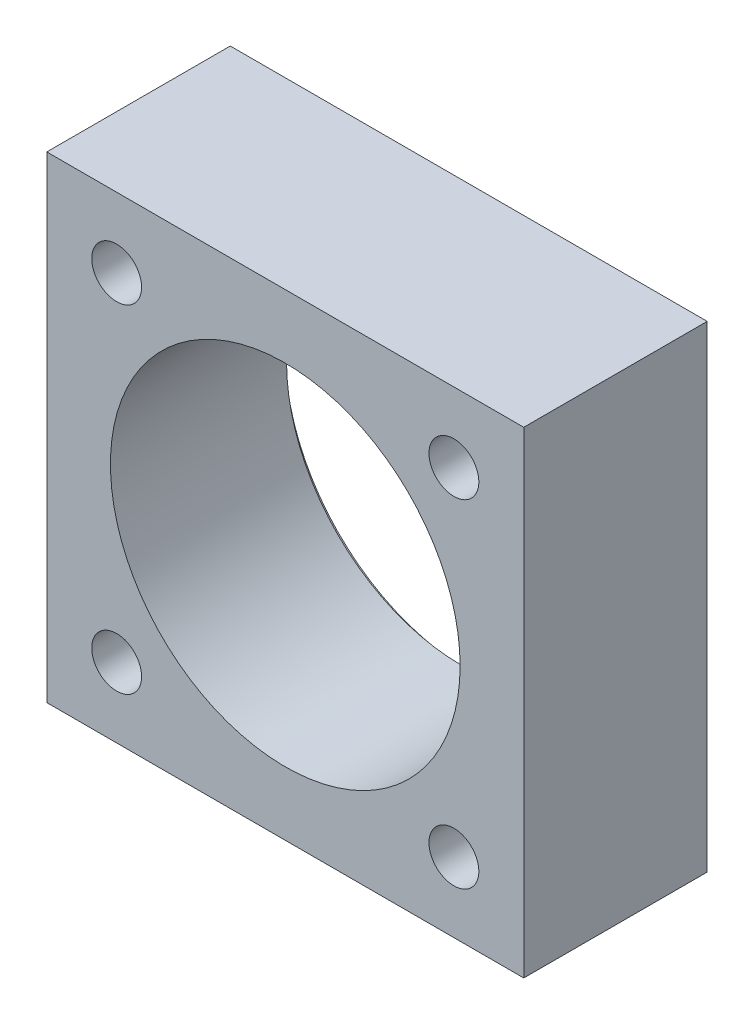
from build123d import *

# Parameters (mm, degrees)
SKETCH2_W             = 33.02
SKETCH2_H             = 33.02
BOSS_EXTRUDE1_DEPTH   = 12.7
SKETCH3_R             = 12.10437
CUT_EXTRUDE1_DEPTH    = 27.579130911
F_8_32_TAPPED_HOLE1_D = 3.4544
SKETCH9_R             = 12.7
CUT_EXTRUDE2_DEPTH    = 0.508


with BuildPart() as part:
    # Sketch2 → Boss-Extrude1 (new body)
    with BuildSketch(Plane.XY):
        Rectangle(SKETCH2_W, SKETCH2_H)
    extrude(amount=BOSS_EXTRUDE1_DEPTH)

    # Sketch3 → Cut-Extrude1 (cut, through all)
    with BuildSketch(Plane.XY.offset(12.7)):
        Circle(SKETCH3_R)
    extrude(amount=-CUT_EXTRUDE1_DEPTH, mode=Mode.SUBTRACT)

    # #8-32 Tapped Hole1 (through all)
    with Locations(Plane.XY.offset(12.7)):
        with Locations((-11.674332957, 11.674332957), (11.674332957, 11.674332957), (11.674332957, -11.674332957), (-11.674332957, -11.674332957)):
            Hole(F_8_32_TAPPED_HOLE1_D / 2)

    # Sketch9 → Cut-Extrude2 (cut)
    with BuildSketch(Plane(origin=(0, 0, 0), x_dir=(-1, 0, 0), z_dir=(0, 0, -1))):
        Circle(SKETCH9_R)
    extrude(amount=-CUT_EXTRUDE2_DEPTH, mode=Mode.SUBTRACT)


solid = part.part
